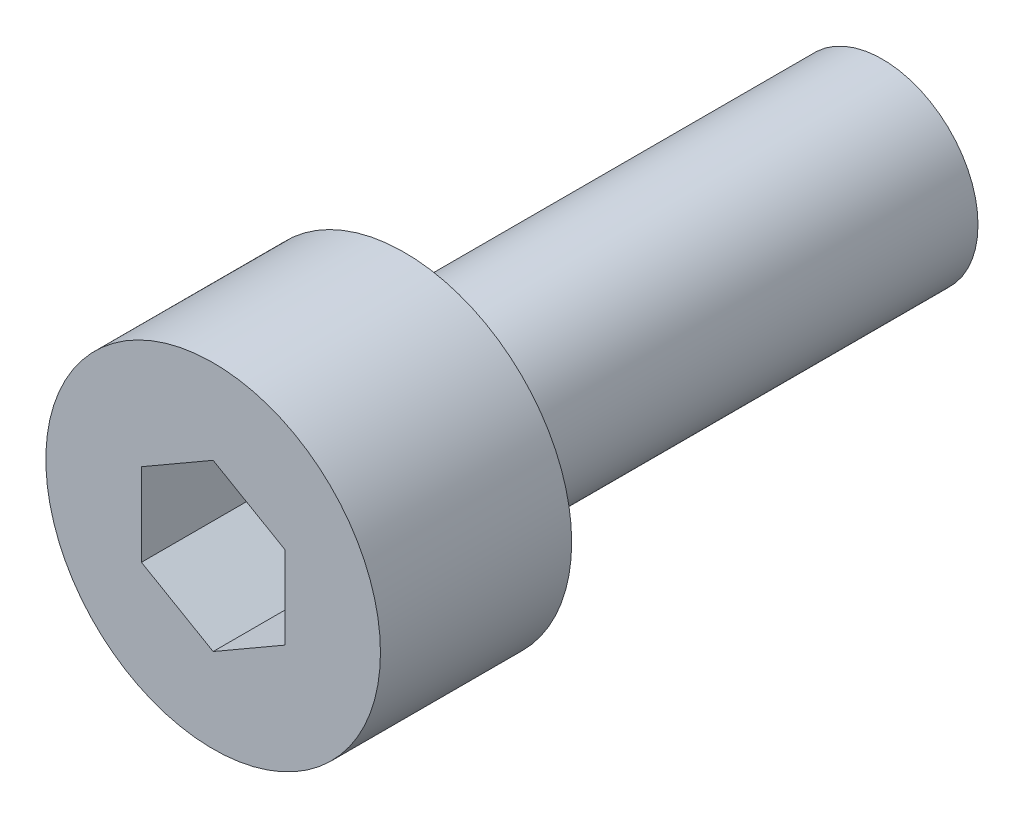
from build123d import *

# Parameters (mm, degrees)
THREAD_ENVELOPE_START = -10
PROFILE_1_R           = 2
THREAD_ENVELOPE_DEPTH = 10
PROFILE_2_R           = 3.5
SOCKET_HEAD_DEPTH     = 4


with BuildPart() as part:
    # Profile_1 → Thread_envelope (new body)
    with BuildSketch(Plane.XY.offset(THREAD_ENVELOPE_START)):
        Circle(PROFILE_1_R)
    extrude(amount=THREAD_ENVELOPE_DEPTH)

    # Profile_2 → Socket_head (add)
    with BuildSketch(Plane.XY):
        Circle(PROFILE_2_R)
        Polygon((1.5, 0.866025404), (0, 1.732050808), (-1.5, 0.866025404), (-1.5, -0.866025404), (0, -1.732050808), (1.5, -0.866025404), align=None, mode=Mode.SUBTRACT)
    extrude(amount=SOCKET_HEAD_DEPTH)


solid = part.part
